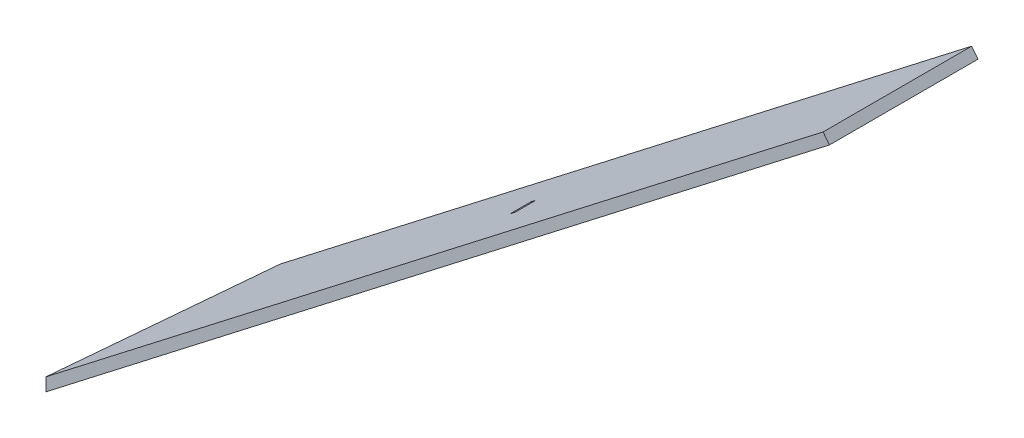
from build123d import *

# Parameters (mm, degrees)
BOSS_EXTRUDE1_DEPTH     = 240.2
CUT_EXTRUDE3_DEPTH      = 540.188032545
CUT_EXTRUDE3_DEPTH_BACK = 540.188032545
SKETCH2_OUTSIDE_W       = 932.224
SKETCH2_OUTSIDE_H       = 412.374
SKETCH2_OUTSIDE_W_2     = 760.049325768
SKETCH2_OUTSIDE_H_2     = 72.06
CUT_EXTRUDE4_DEPTH      = 540.188032545
CUT_EXTRUDE5_DEPTH      = 540.182188788
CUT_EXTRUDE5_DEPTH_BACK = 540.182188788
SKETCH4_W               = 3
SKETCH4_H               = 10


with BuildPart() as part:
    # Sketch1 → Boss-Extrude1 (new body)
    with BuildSketch(Plane.XY):
        Polygon((0, 0), (380.024662884, 293.716437401), (376.967027683, 297.672555066), (0, 6.319326703), (-376.967027683, 297.672555066), (-380.024662884, 293.716437401), align=None)
    extrude(amount=-BOSS_EXTRUDE1_DEPTH)

    # Sketch2 outside → Cut-Extrude3 (cut, two sides: drawn at the far end of the back side and taken through both)
    with BuildSketch(Plane(origin=(0, 0, 0), x_dir=(1, 0, 0), z_dir=(0, 1, 0)).offset(-CUT_EXTRUDE3_DEPTH_BACK)):
        with Locations((0, 120.1)):
            Rectangle(SKETCH2_OUTSIDE_W, SKETCH2_OUTSIDE_H)
        with Locations((0, 204.17)):
            Rectangle(SKETCH2_OUTSIDE_W_2, SKETCH2_OUTSIDE_H_2, mode=Mode.SUBTRACT)
    extrude(amount=CUT_EXTRUDE3_DEPTH + CUT_EXTRUDE3_DEPTH_BACK, mode=Mode.SUBTRACT)

    # Sketch3 → Cut-Extrude4 (cut, through all)
    with BuildSketch(Plane(origin=(0, 0, 0), x_dir=(1, 0, 0), z_dir=(0, 1, 0))):
        Polygon((41.603860398, 240.2), (-41.603860398, 240.2), (0, 168.14), align=None)
        Polygon((-380.024662884, 168.14), (0, 168.14), (-41.603860398, 240.2), (-380.024662884, 240.2), align=None)
    extrude(amount=CUT_EXTRUDE4_DEPTH, mode=Mode.SUBTRACT)

    # Sketch4 → Cut-Extrude5 (cut, two sides: drawn at the far end of the back side and taken through both)
    with BuildSketch(Plane(origin=(-3.057635201, 3.956117665, 0), x_dir=(0.7912235329674889, 0.6115270401858327, 0), z_dir=(-0.6115270401858327, 0.7912235329674889, 0)).offset(-CUT_EXTRUDE5_DEPTH_BACK)):
        with Locations((250.782219577, 204.17)):
            Rectangle(SKETCH4_W, SKETCH4_H)
    extrude(amount=CUT_EXTRUDE5_DEPTH + CUT_EXTRUDE5_DEPTH_BACK, mode=Mode.SUBTRACT)


solid = part.part
